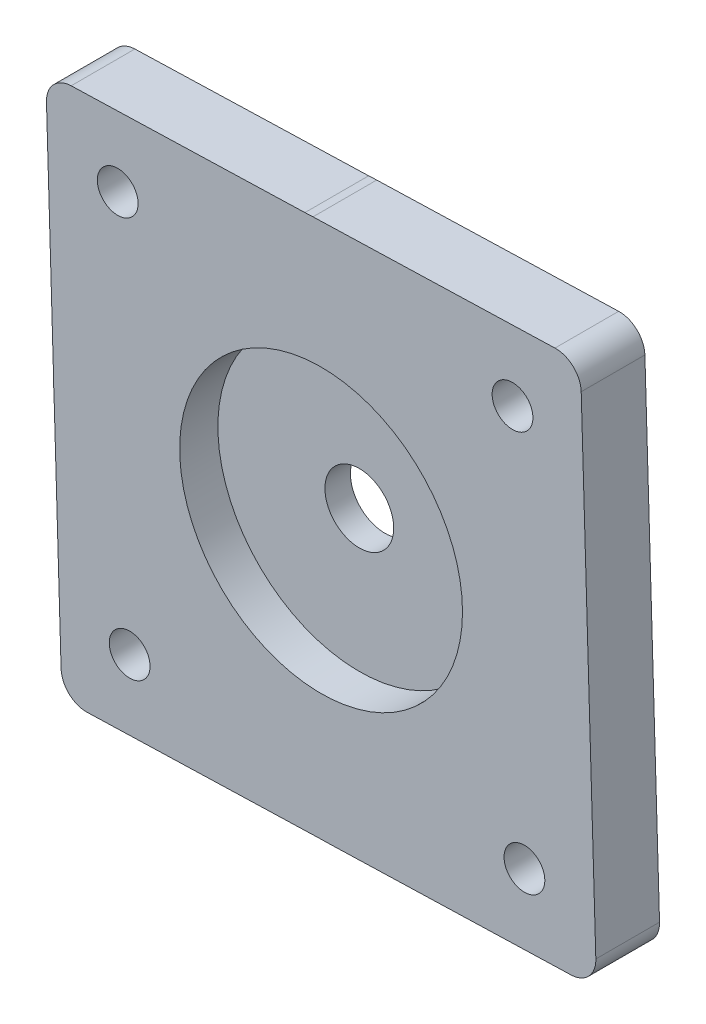
from build123d import *

# Parameters (mm, degrees)
SKETCH1_R           = 1.6
BOSS_EXTRUDE1_DEPTH = 5
SKETCH3_R           = 11.1
CUT_EXTRUDE1_DEPTH  = 3
SKETCH4_R           = 2.7
CUT_EXTRUDE2_DEPTH  = 3


with BuildPart() as part:
    # Sketch1 → Boss-Extrude1 (new body)
    with BuildSketch(Plane.XY):
        with BuildLine():
            Line((18.357006817, 21.564329359), (-0.634323451, 20.990417665))
            ThreePointArc((-0.634323451, 20.990417665), (-0.95130426, 20.978441796), (-1.268068016, 20.961679406))
            Line((-1.268068016, 20.961679406), (-19.615786314, 20.407217452))
            ThreePointArc((-19.615786314, 20.407217452), (-21.011660375, 19.778980746), (-21.554461954, 18.347718298))
            Line((-21.554461954, 18.347718298), (-21, 0))
            ThreePointArc((-21, 0), (-20.990417665, -0.634323451), (-20.961679406, -1.268068016))
            Line((-20.961679406, -1.268068016), (-20.407217422, -19.615787304))
            ThreePointArc((-20.407217422, -19.615787304), (-19.778980677, -21.011661401), (-18.34771816, -21.55446294))
            Line((-18.34771816, -21.55446294), (0, -21))
            ThreePointArc((0, -21), (0.317197912, -20.99760428), (0.634323451, -20.990417665))
            Line((0.634323451, -20.990417665), (19.62565372, -20.416505971))
            ThreePointArc((19.62565372, -20.416505971), (21.02152778, -19.788269266), (21.564329359, -18.357006817))
            Line((21.564329359, -18.357006817), (20.416505971, 19.62565372))
            ThreePointArc((20.416505971, 19.62565372), (19.788269266, 21.02152778), (18.357006817, 21.564329359))
        make_face()
        with Locations((15.024736206, 15.961118443)):
            Circle(SKETCH1_R, mode=Mode.SUBTRACT)
        with Locations((15.961118443, -15.024736206)):
            Circle(SKETCH1_R, mode=Mode.SUBTRACT)
        with Locations((-15.024736206, -15.961118443)):
            Circle(SKETCH1_R, mode=Mode.SUBTRACT)
        with Locations((-15.961118443, 15.024736206)):
            Circle(SKETCH1_R, mode=Mode.SUBTRACT)
    extrude(amount=BOSS_EXTRUDE1_DEPTH)

    # Sketch3 → Cut-Extrude1 (cut)
    with BuildSketch(Plane.XY.offset(5)):
        Circle(SKETCH3_R)
    extrude(amount=-CUT_EXTRUDE1_DEPTH, mode=Mode.SUBTRACT)

    # Sketch4 → Cut-Extrude2 (cut)
    with BuildSketch(Plane.XY.offset(2)):
        Circle(SKETCH4_R)
    extrude(amount=-CUT_EXTRUDE2_DEPTH, mode=Mode.SUBTRACT)


solid = part.part
